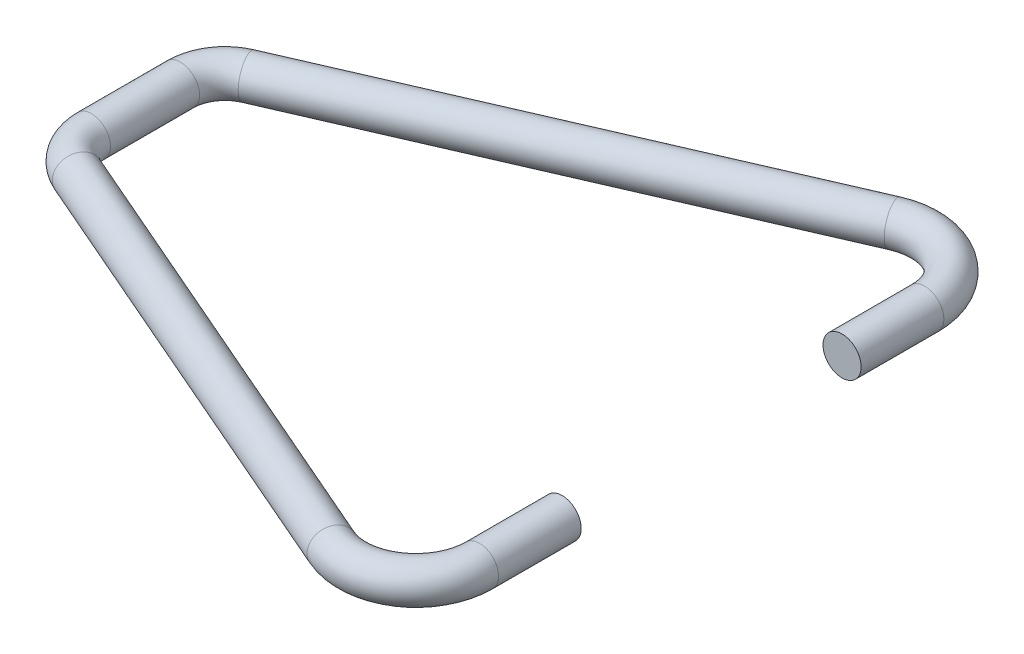
from build123d import *

# Parameters (mm, degrees)
CROQUIS2_R = 3


with BuildPart() as part:
    # Barrer1: sweep along a path in Croquis1
    with BuildLine(Plane(origin=(0, 0, 0), x_dir=(1, 0, 0), z_dir=(0, 1, 0))) as barrer1_path:
        Line((0, 0), (0, 7))
        ThreePointArc((0, 7), (1.146798787, 10.839275396), (4.211438733, 13.420586115))
        Line((4.211438733, 13.420586115), (75.016341047, 44.172265879))
        ThreePointArc((75.016341047, 44.172265879), (84.484679137, 43.361716018), (89, 35))
        Line((89, 35), (89, 22))
    # Croquis2 → Barrer1 (sweep)
    with BuildSketch(Plane.XY):
        Circle(CROQUIS2_R)
    barrer1 = sweep(path=barrer1_path.line)

    # Simetría1: Barrer1 across plane
    add(barrer1.mirror(Plane.XY))


solid = part.part
